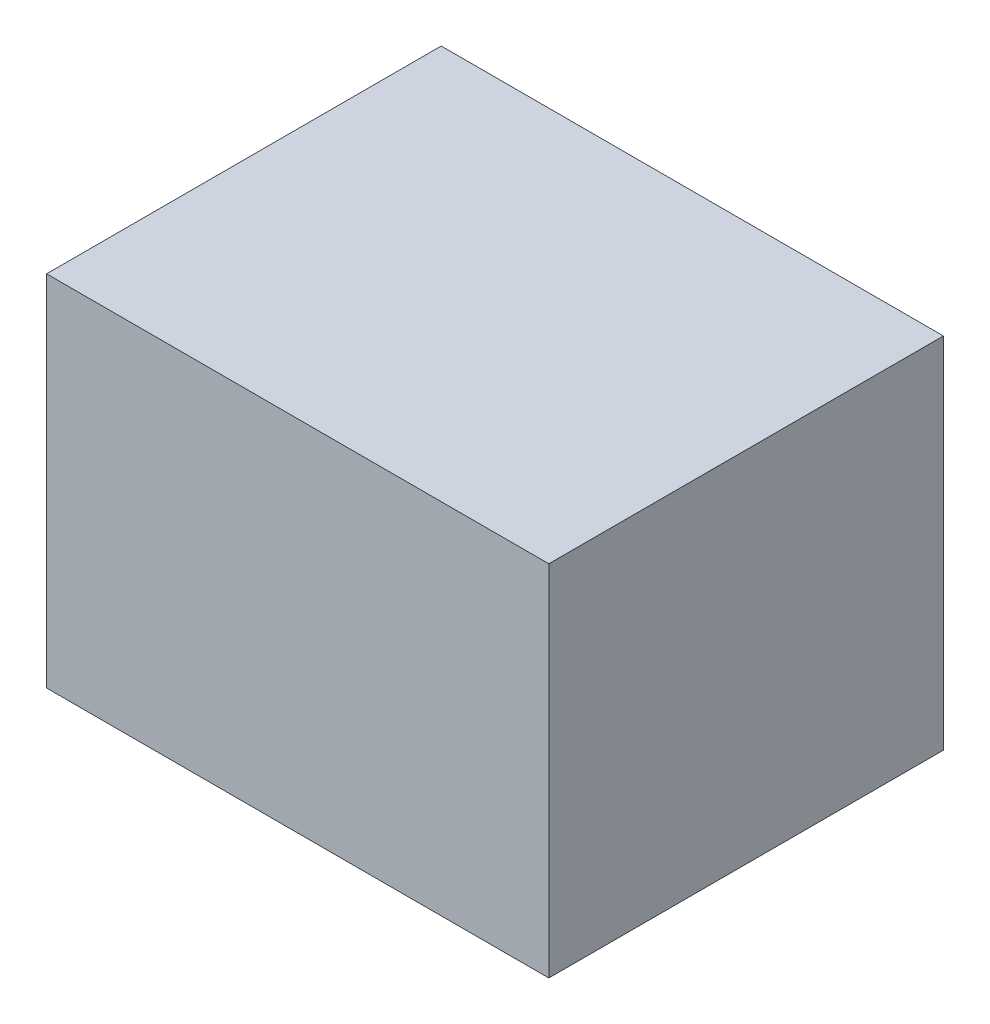
from build123d import *

# Parameters (mm, degrees)
SKETCH1_W           = 71.12
SKETCH1_H           = 55.88
BOSS_EXTRUDE1_DEPTH = 50.8


with BuildPart() as part:
    # Sketch1 → Boss-Extrude1 (new body)
    with BuildSketch(Plane(origin=(0, 0, 0), x_dir=(1, 0, 0), z_dir=(0, 1, 0))):
        with Locations((35.56, 27.94)):
            Rectangle(SKETCH1_W, SKETCH1_H)
    extrude(amount=BOSS_EXTRUDE1_DEPTH)


solid = part.part
